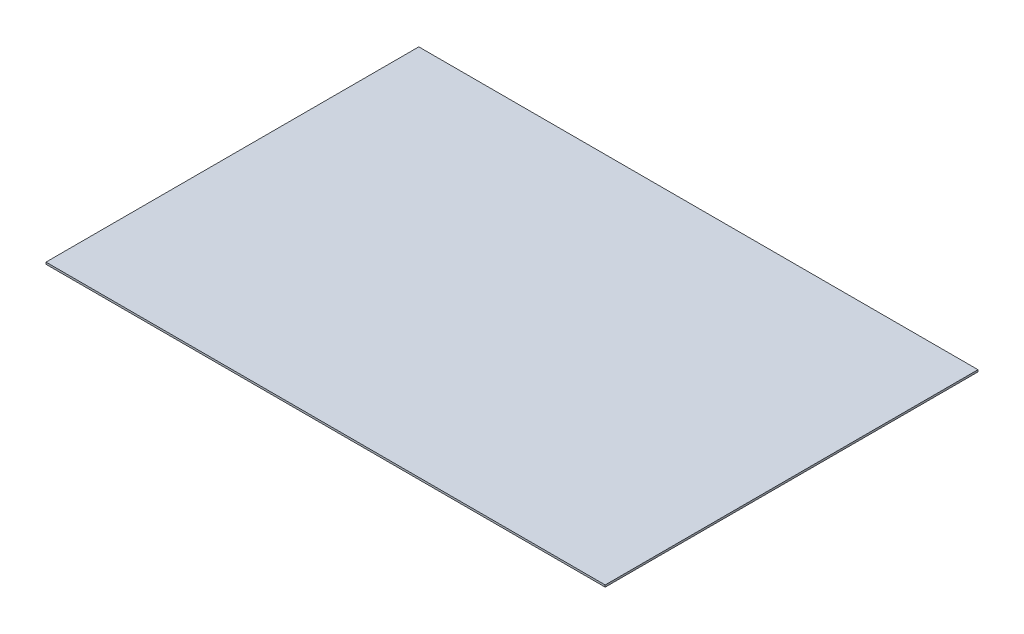
from build123d import *

# Parameters (mm, degrees)
SKETCH1_W           = 1828.8
SKETCH1_H           = 1219.2
BOSS_EXTRUDE1_DEPTH = 6.35


with BuildPart() as part:
    # Sketch1 → Boss-Extrude1 (new body)
    with BuildSketch(Plane(origin=(0, 0, 0), x_dir=(1, 0, 0), z_dir=(0, 1, 0))):
        Rectangle(SKETCH1_W, SKETCH1_H)
    extrude(amount=BOSS_EXTRUDE1_DEPTH)


solid = part.part
